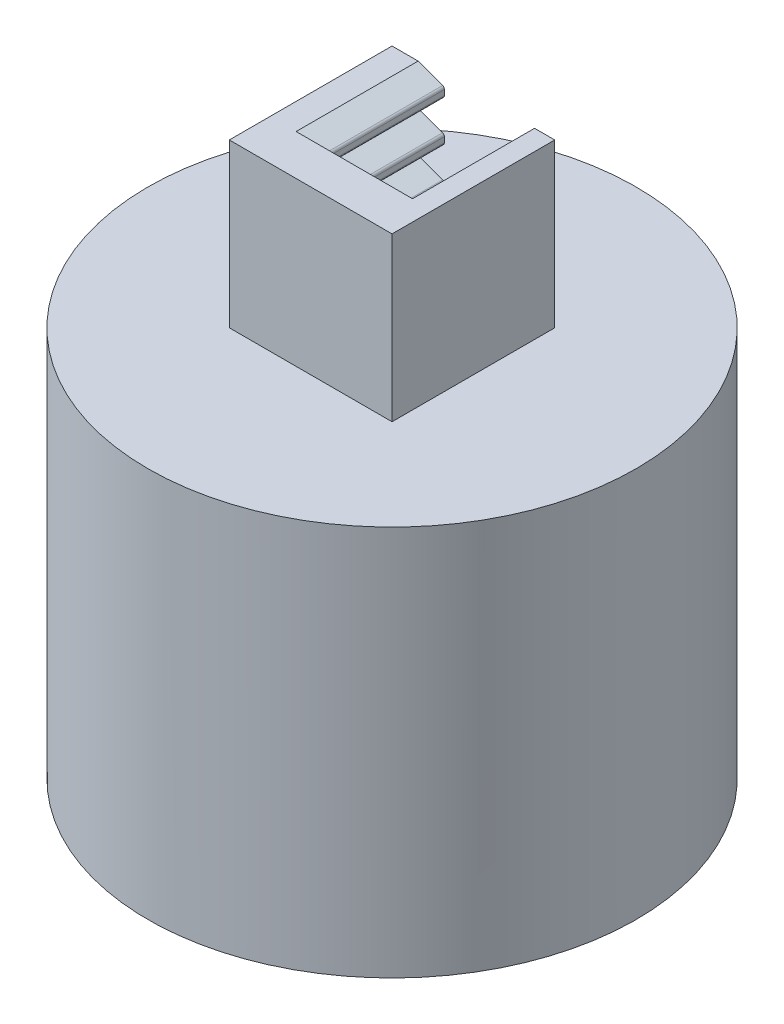
from build123d import *

# Parameters (mm, degrees)
SKETCH1_R           = 15
SKETCH1_R_2         = 13
BOSS_EXTRUDE1_DEPTH = 20
SKETCH2_R           = 15
BOSS_EXTRUDE2_DEPTH = 4
SKETCH4_W           = 10
SKETCH4_H           = 10
BOSS_EXTRUDE3_DEPTH = 10
CUT_EXTRUDE2_DEPTH  = 7.5
CUT_EXTRUDE3_DEPTH  = 5


with BuildPart() as part:
    # Sketch1 → Boss-Extrude1 (new body)
    with BuildSketch(Plane(origin=(0, 0, 0), x_dir=(1, 0, 0), z_dir=(0, 1, 0))):
        with Locations(Location((0, 0, 0), (0, 0, 270))):
            Circle(SKETCH1_R)
        with Locations(Location((0, 0, 0), (0, 0, 270))):
            Circle(SKETCH1_R_2, mode=Mode.SUBTRACT)
    extrude(amount=BOSS_EXTRUDE1_DEPTH)

    # Sketch2 → Boss-Extrude2 (add)
    with BuildSketch(Plane(origin=(0, 20, 0), x_dir=(1, 0, 0), z_dir=(0, 1, 0))):
        with Locations(Location((0, 0, 0), (0, 0, 270))):
            Circle(SKETCH2_R)
    extrude(amount=BOSS_EXTRUDE2_DEPTH)

    # Sketch4 → Boss-Extrude3 (add)
    with BuildSketch(Plane(origin=(0, 24, 0), x_dir=(1, 0, 0), z_dir=(0, 1, 0))):
        Rectangle(SKETCH4_W, SKETCH4_H)
    extrude(amount=BOSS_EXTRUDE3_DEPTH)

    # Sketch6 → Cut-Extrude2 (cut)
    with BuildSketch(Plane(origin=(0, 0, -5), x_dir=(-1, 0, 0), z_dir=(0, 0, -1))):
        with BuildLine():
            Line((-1.758355149, 34), (-3.758355149, 34))
            Line((-3.758355149, 34), (-3.758355149, 24))
            Line((-3.758355149, 24), (3.541644851, 24))
            Line((3.541644851, 24), (3.541644851, 24.674283625))
            Line((3.541644851, 24.674283625), (1.891753796, 25.274794859))
            ThreePointArc((1.891753796, 25.274794859), (1.811908661, 25.336062186), (1.781644851, 25.432046729))
            Line((1.781644851, 25.432046729), (1.781644851, 25.755508896))
            ThreePointArc((1.781644851, 25.755508896), (1.811908661, 25.85149344), (1.891753796, 25.912760766))
            Line((1.891753796, 25.912760766), (3.541644851, 26.513272))
            Line((3.541644851, 26.513272), (3.541644851, 27.187555625))
            Line((3.541644851, 27.187555625), (1.891753796, 27.788066859))
            ThreePointArc((1.891753796, 27.788066859), (1.811908661, 27.849334186), (1.781644851, 27.945318729))
            Line((1.781644851, 27.945318729), (1.781644851, 28.268780896))
            ThreePointArc((1.781644851, 28.268780896), (1.811908661, 28.36476544), (1.891753796, 28.426032766))
            Line((1.891753796, 28.426032766), (3.541644851, 29.026544))
            Line((3.541644851, 29.026544), (3.541644851, 29.700827625))
            Line((3.541644851, 29.700827625), (1.891753796, 30.301338859))
            ThreePointArc((1.891753796, 30.301338859), (1.811908661, 30.362606186), (1.781644851, 30.458590729))
            Line((1.781644851, 30.458590729), (1.781644851, 30.782052896))
            ThreePointArc((1.781644851, 30.782052896), (1.811908661, 30.87803744), (1.891753796, 30.939304766))
            Line((1.891753796, 30.939304766), (3.541644851, 31.539816))
            Line((3.541644851, 31.539816), (3.541644851, 32.214099625))
            Line((3.541644851, 32.214099625), (1.891753796, 32.814610859))
            ThreePointArc((1.891753796, 32.814610859), (1.811908661, 32.875878186), (1.781644851, 32.971862729))
            Line((1.781644851, 32.971862729), (1.781644851, 33.295324896))
            ThreePointArc((1.781644851, 33.295324896), (1.811908661, 33.39130944), (1.891753796, 33.452576766))
            Line((1.891753796, 33.452576766), (3.39578677, 34))
            Line((3.39578677, 34), (0.241644851, 34))
            Line((0.241644851, 34), (-1.758355149, 34))
        make_face()
    extrude(amount=-CUT_EXTRUDE2_DEPTH, mode=Mode.SUBTRACT)

    # Sketch8 → Cut-Extrude3 (cut)
    with BuildSketch(Plane(origin=(0, 0, -15), x_dir=(-1, 0, 0), z_dir=(0, 0, -1))):
        Polygon((-6, 12), (-2, 12), (-2, 0), (2, 0), (2, 12), (6, 12), (6, 20), (-6, 20), align=None)
    extrude(amount=-CUT_EXTRUDE3_DEPTH, mode=Mode.SUBTRACT)


solid = part.part
